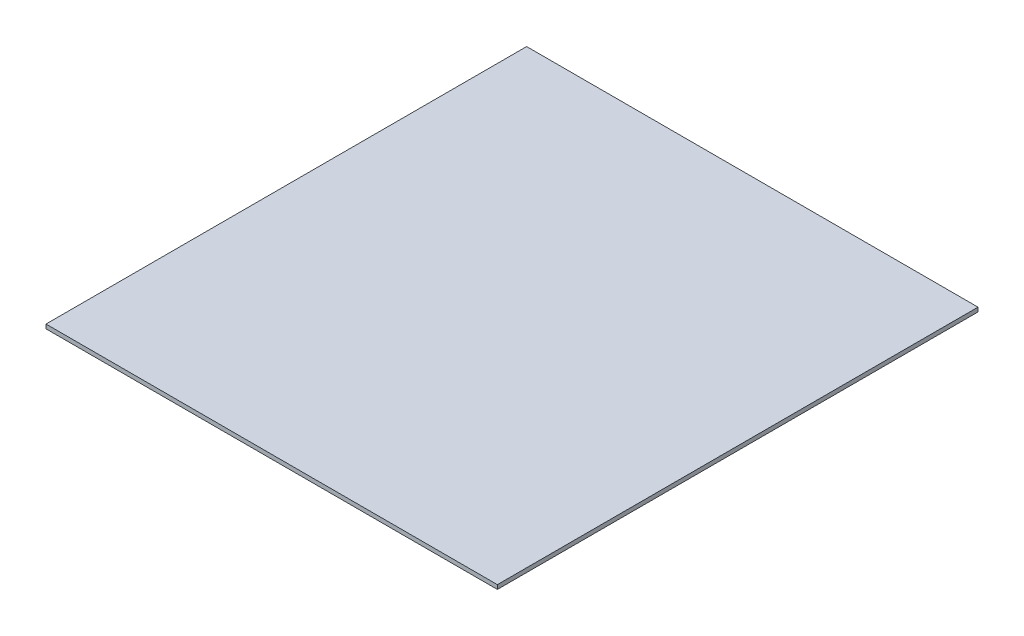
from build123d import *

# Parameters (mm, degrees)
SKETCH1_W           = 540
SKETCH1_H           = 575
BOSS_EXTRUDE1_DEPTH = 5


with BuildPart() as part:
    # Sketch1 → Boss-Extrude1 (new body)
    with BuildSketch(Plane(origin=(0, 0, 0), x_dir=(1, 0, 0), z_dir=(0, 1, 0))):
        with Locations((-270, -287.5)):
            Rectangle(SKETCH1_W, SKETCH1_H)
    extrude(amount=BOSS_EXTRUDE1_DEPTH)


solid = part.part
